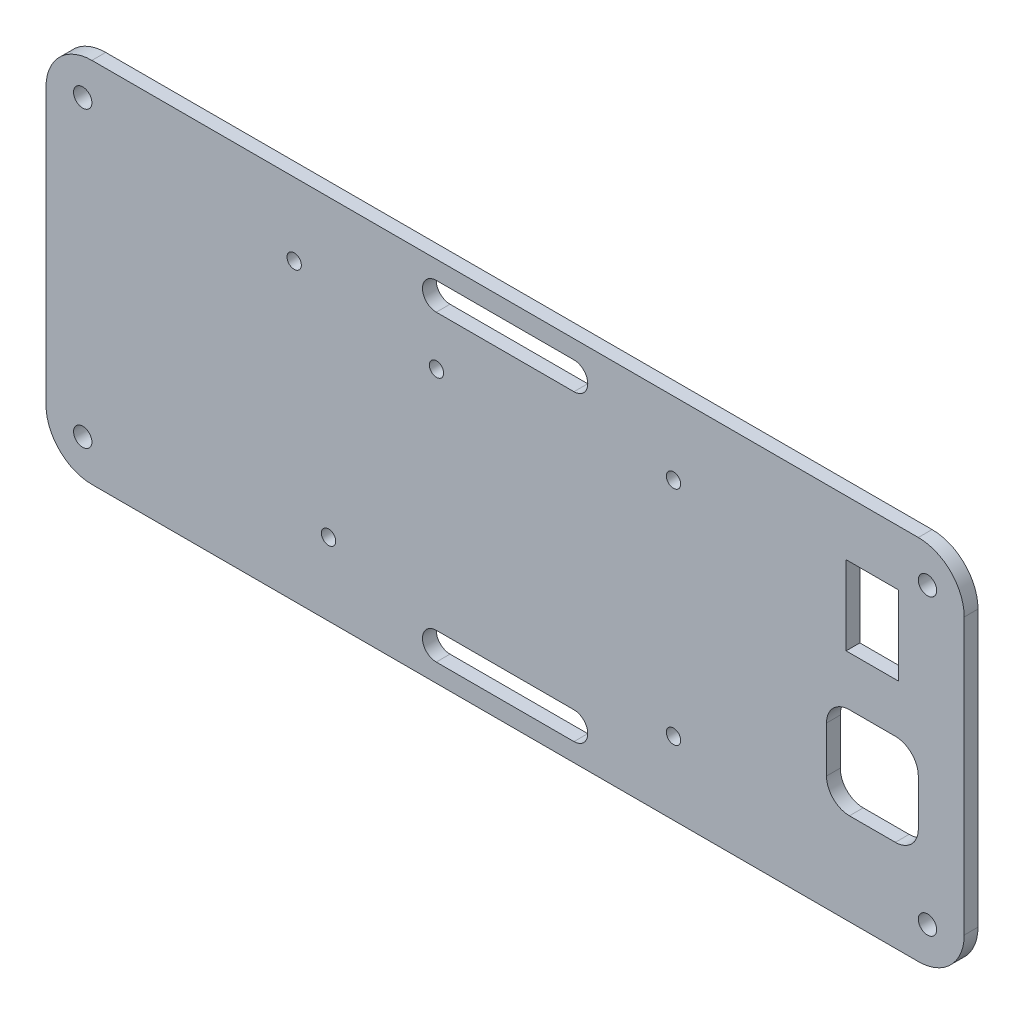
from build123d import *

# Parameters (mm, degrees)
SKETCH1_W           = 200
SKETCH1_H           = 80
BOSS_EXTRUDE1_DEPTH = 3
SKETCH2_R           = 2
CUT_EXTRUDE1_DEPTH  = 108.745069493
FILLET1_R           = 10
SKETCH3_R           = 1.5621
CUT_EXTRUDE2_DEPTH  = 108.745069493
SKETCH4_W           = 20
SKETCH4_H           = 20
CUT_EXTRUDE3_DEPTH  = 108.745069493
FILLET2_R           = 5
CUT_EXTRUDE4_DEPTH  = 108.745069493
SKETCH6_W           = 11.45
SKETCH6_H           = 17.2
CUT_EXTRUDE5_DEPTH  = 108.745069493


with BuildPart() as part:
    # Sketch1 → Boss-Extrude1 (new body)
    with BuildSketch(Plane.XY):
        Rectangle(SKETCH1_W, SKETCH1_H)
    extrude(amount=BOSS_EXTRUDE1_DEPTH)

    # Sketch2 → Cut-Extrude1 (cut, through all)
    with BuildSketch(Plane.XY.offset(3)):
        with Locations((-92, 32)):
            Circle(SKETCH2_R)
        with Locations(Location((-92, -32, 0), (0, 0, 180))):
            Circle(SKETCH2_R)
        with Locations((92, -32)):
            Circle(SKETCH2_R)
        with Locations(Location((92, 32, 0), (0, 0, 180))):
            Circle(SKETCH2_R)
    extrude(amount=-CUT_EXTRUDE1_DEPTH, mode=Mode.SUBTRACT)

    # Fillet1
    fillet1_edges = [part.edges().sort_by_distance(p)[0] for p in [
        (100, -40, 1.5),
        (-100, -40, 1.5),
        (-100, 40, 1.5),
        (100, 40, 1.5),
    ]]
    fillet(fillet1_edges, radius=FILLET1_R)

    # Sketch3 → Cut-Extrude2 (cut, through all)
    with BuildSketch(Plane.XY.offset(3)):
        with Locations((36.6776, 24.1681)):
            Circle(SKETCH3_R)
        with Locations((36.6776, -24.1681)):
            Circle(SKETCH3_R)
        with Locations((-38.4556, -24.1681)):
            Circle(SKETCH3_R)
        with Locations((-45.9486, 24.1681)):
            Circle(SKETCH3_R)
        with Locations((-14.9479, 19.289607234)):
            Circle(SKETCH3_R)
    extrude(amount=-CUT_EXTRUDE2_DEPTH, mode=Mode.SUBTRACT)

    # Sketch4 → Cut-Extrude3 (cut, through all)
    with BuildSketch(Plane.XY.offset(3)):
        with Locations((80, -10)):
            Rectangle(SKETCH4_W, SKETCH4_H)
    extrude(amount=-CUT_EXTRUDE3_DEPTH, mode=Mode.SUBTRACT)

    # Fillet2
    fillet2_edges = [part.edges().sort_by_distance(p)[0] for p in [
        (90, 0, 1.5),
        (90, -20, 1.5),
        (70, -20, 1.5),
        (70, 0, 1.5),
    ]]
    fillet(fillet2_edges, radius=FILLET2_R)

    # Sketch5 → Cut-Extrude4 (cut, through all)
    with BuildSketch(Plane.XY.offset(3)):
        with BuildLine():
            Line((-15, -30), (15, -30))
            ThreePointArc((15, -30), (18, -33), (15, -36))
            Line((15, -36), (-15, -36))
            ThreePointArc((-15, -36), (-18, -33), (-15, -30))
        make_face()
        with BuildLine():
            Line((-15, 30), (15, 30))
            ThreePointArc((15, 30), (18, 33), (15, 36))
            Line((15, 36), (-15, 36))
            ThreePointArc((-15, 36), (-18, 33), (-15, 30))
        make_face()
    extrude(amount=-CUT_EXTRUDE4_DEPTH, mode=Mode.SUBTRACT)

    # Sketch6 → Cut-Extrude5 (cut, through all)
    with BuildSketch(Plane.XY.offset(3)):
        with Locations((80, 19.35)):
            Rectangle(SKETCH6_W, SKETCH6_H)
    extrude(amount=-CUT_EXTRUDE5_DEPTH, mode=Mode.SUBTRACT)


solid = part.part
